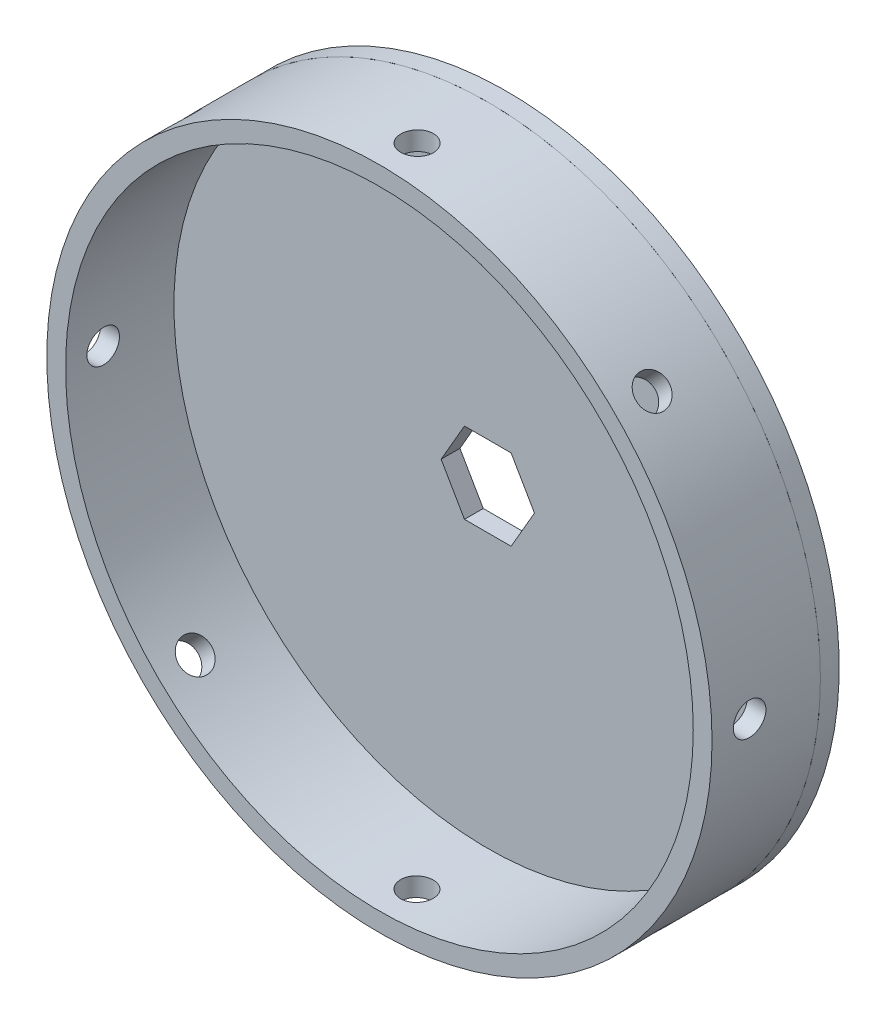
from build123d import *

# Parameters (mm, degrees)
SKETCH_1_R               = 53.1
SKETCH_1_R_2             = 50.1
EXTRUDE_1_DEPTH          = 22.3
EXTRUDE_START            = 3
SKETCH_2_R               = 53.1
EXTRUDE_2_DEPTH          = 3
SKETCH_4_R               = 2.6
CUT_EXTRUDE_3_DEPTH      = 121.81117498
PATTERN_CIRCULAR_1_COUNT = 8
CUT_EXTRUDE_4_DEPTH      = 10
SKETCH_5_R               = 65.353974711
CUT_EXTRUDE_5_DEPTH      = 5


with BuildPart() as part:
    # 草图1 → 凸台-拉伸1 (new body)
    with BuildSketch(Plane.XY):
        Circle(SKETCH_1_R)
        Circle(SKETCH_1_R_2, mode=Mode.SUBTRACT)
    extrude(amount=EXTRUDE_1_DEPTH)

    # 草图4 → 切除-拉伸3 (cut, through all)
    with BuildSketch(Plane(origin=(0, 53.1, 0), x_dir=(1, 0, 0), z_dir=(0, 1, 0))):
        with Locations(Location((0, -11.3, 0), (0, 0, 270))):
            Circle(SKETCH_4_R)
    cut_extrude_3 = extrude(amount=-CUT_EXTRUDE_3_DEPTH, mode=Mode.SUBTRACT)

    # 阵列(圆周)1: 切除-拉伸3 ×8 about axis
    pattern_circular_1_axis = Axis((0, 0, -3), (0, 0, -1))
    for i in range(1, PATTERN_CIRCULAR_1_COUNT):
        add(cut_extrude_3.rotate(pattern_circular_1_axis, i * 360 / PATTERN_CIRCULAR_1_COUNT), mode=Mode.SUBTRACT)

    # 草图5 → 切除-拉伸5 (cut)
    with BuildSketch(Plane.XY.offset(22.3)):
        Circle(SKETCH_5_R)
    extrude(amount=-CUT_EXTRUDE_5_DEPTH, mode=Mode.SUBTRACT)


with BuildPart() as body_2:
    # 草图2 → 凸台-拉伸2 (new body)
    with BuildSketch(Plane(origin=(0, 0, 0), x_dir=(-1, 0, 0), z_dir=(0, 0, -1)).offset(EXTRUDE_START)):
        Circle(SKETCH_2_R)
    extrude(amount=-EXTRUDE_2_DEPTH)

    # 草图3 → 切除-拉伸4 (cut)
    with BuildSketch(Plane(origin=(0, 0, -3), x_dir=(-1, 0, 0), z_dir=(0, 0, -1))):
        Polygon((3.723909236, -6.45), (7.447818473, 0), (3.723909236, 6.45), (-3.723909236, 6.45), (-7.447818473, 0), (-3.723909236, -6.45), align=None)
    extrude(amount=-CUT_EXTRUDE_4_DEPTH, mode=Mode.SUBTRACT)


solid = Compound([part.part, body_2.part])
